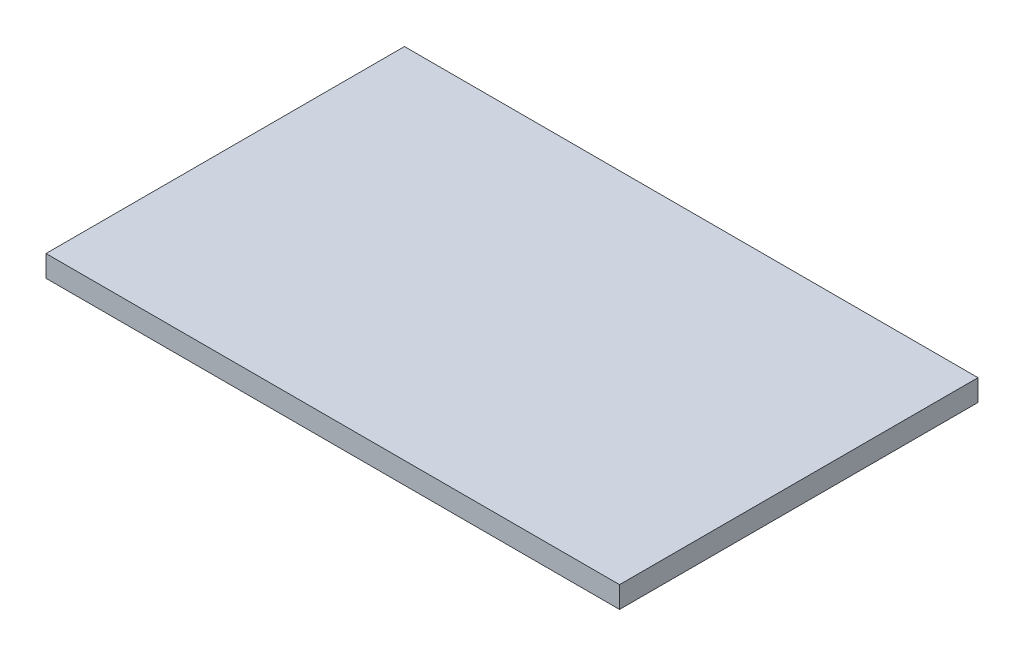
from build123d import *

# Parameters (mm, degrees)
SKETCH1_W           = 80
SKETCH1_H           = 50
BOSS_EXTRUDE1_DEPTH = 3


with BuildPart() as part:
    # Sketch1 → Boss-Extrude1 (new body)
    with BuildSketch(Plane(origin=(0, 0, 0), x_dir=(1, 0, 0), z_dir=(0, 1, 0))):
        with Locations((10.333989977, 11.263932627)):
            Rectangle(SKETCH1_W, SKETCH1_H)
    extrude(amount=BOSS_EXTRUDE1_DEPTH)


solid = part.part
